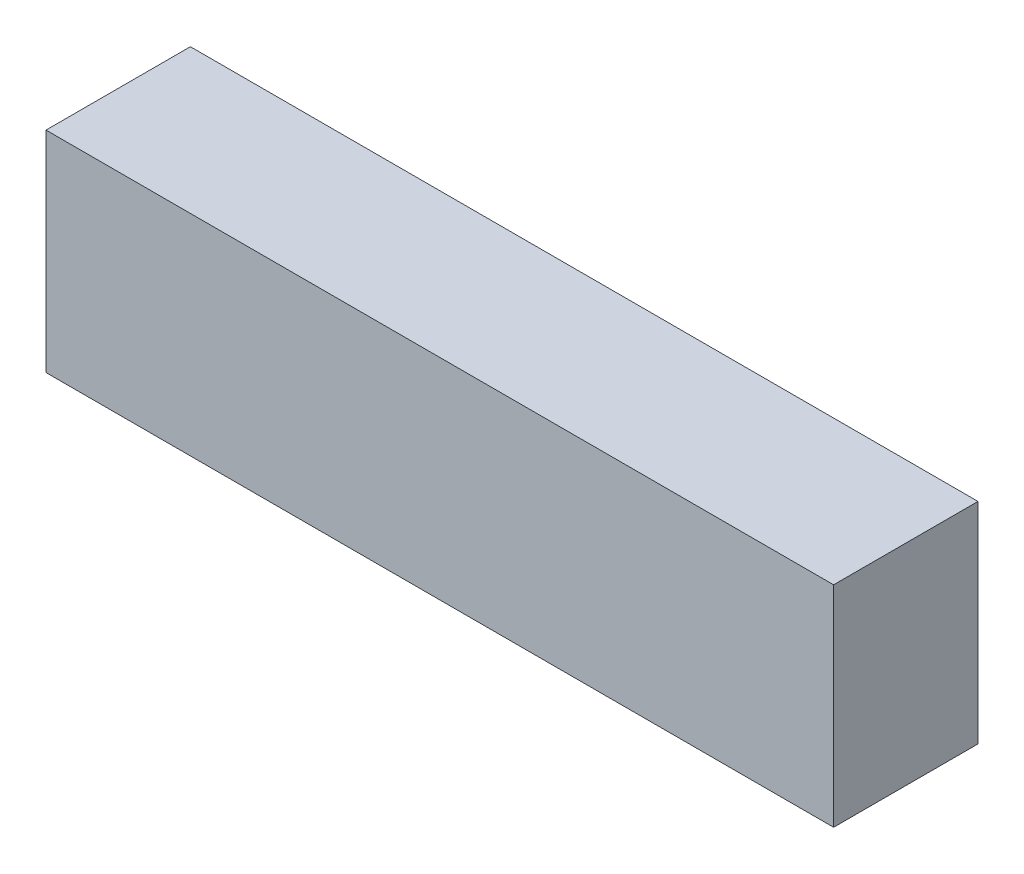
from build123d import *

# Parameters (mm, degrees)
SKETCH_1_W      = 30
SKETCH_1_H      = 5.5
EXTRUDE_1_DEPTH = 8


with BuildPart() as part:
    # 草图1 → 凸台-拉伸1 (new body)
    with BuildSketch(Plane(origin=(0, 0, 0), x_dir=(1, 0, 0), z_dir=(0, 1, 0))):
        Rectangle(SKETCH_1_W, SKETCH_1_H)
    extrude(amount=EXTRUDE_1_DEPTH)


solid = part.part
